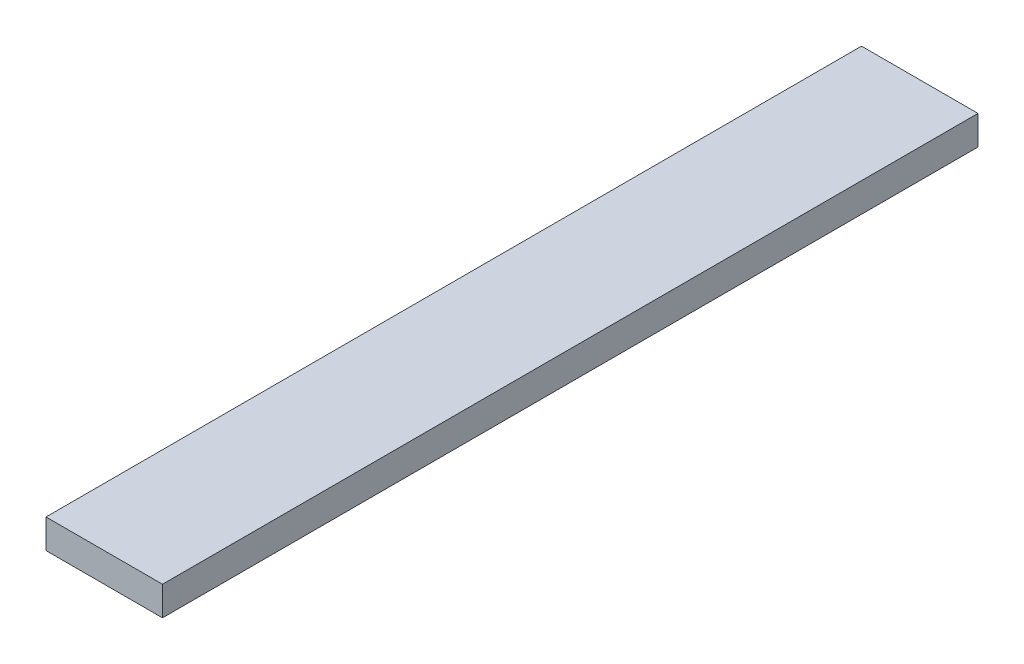
from build123d import *

# Parameters (mm, degrees)
SKETCH1_W           = 25.4
SKETCH1_H           = 177.8
BOSS_EXTRUDE1_DEPTH = 6.35


with BuildPart() as part:
    # Sketch1 → Boss-Extrude1 (new body)
    with BuildSketch(Plane(origin=(0, 0, 0), x_dir=(1, 0, 0), z_dir=(0, 1, 0))):
        Rectangle(SKETCH1_W, SKETCH1_H)
    extrude(amount=BOSS_EXTRUDE1_DEPTH)


solid = part.part
